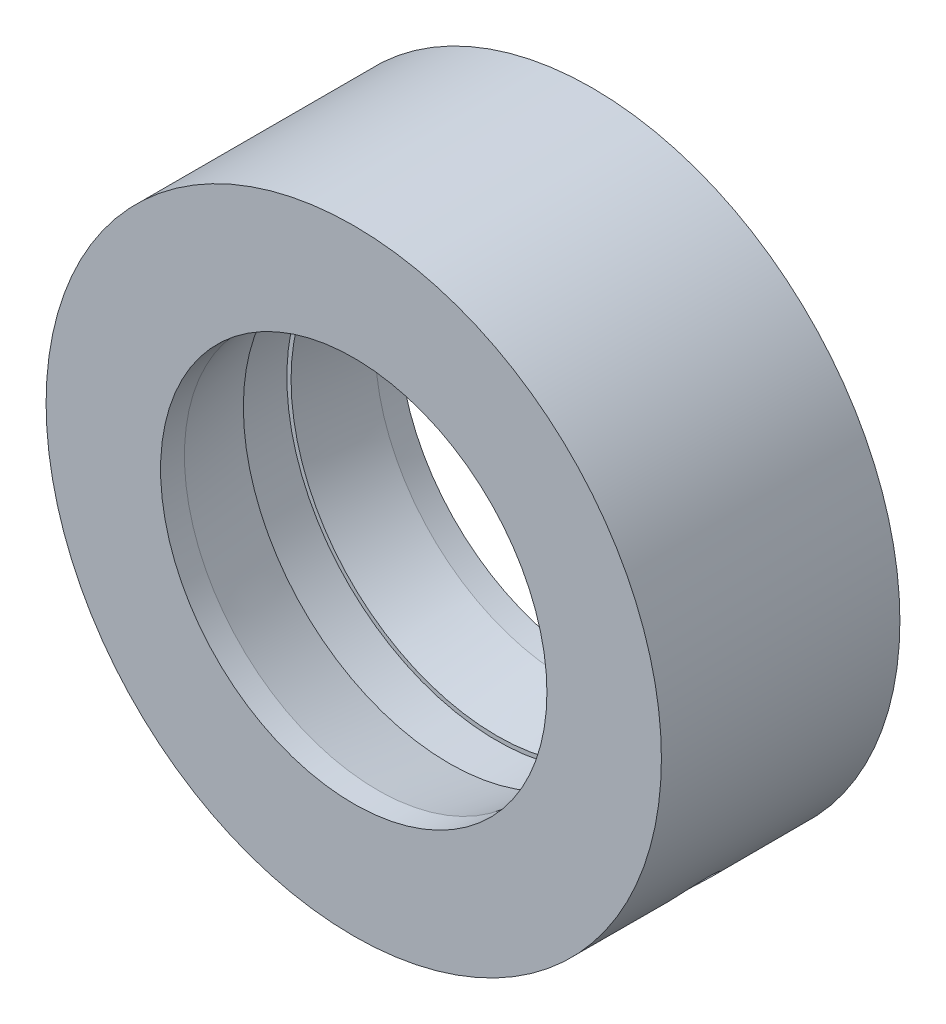
from build123d import *

# Parameters (mm, degrees)
SKETCH1_R               = 12.9
SKETCH1_R_2             = 8.1
BOSS_EXTRUDE1_DEPTH     = 8
CUT_EXTRUDE1_DEPTH      = 1
CUT_EXTRUDE1_DEPTH_BACK = 1
SKETCH3_R               = 8.805307923
SKETCH4_R               = 1
CUT_EXTRUDE2_DEPTH      = 6
FILLET1_R               = 3
FILLET2_R               = 5
SKETCH5_R               = 1
CUT_EXTRUDE3_DEPTH      = 10
DRAFT4_ANGLE            = -10
DRAFT6_ANGLE            = -10
SKETCH6_R               = 1
CUT_EXTRUDE4_DEPTH      = 10
BOSS_EXTRUDE3_START     = 1
SKETCH7_R               = 8.1
BOSS_EXTRUDE3_DEPTH     = 1
SKETCH11_R              = 8.1
BOSS_EXTRUDE4_DEPTH     = 1
SKETCH12_OUTSIDE_W      = 157.242
SKETCH12_OUTSIDE_H      = 107.242
SKETCH12_OUTSIDE_R      = 12.9
CUT_EXTRUDE5_DEPTH      = 108.3070569


with BuildPart() as part:
    # Sketch1 → Boss-Extrude1 (new body)
    # profile 1 of 8: a face of its own
    with BuildSketch(Plane.XY):
        with Locations((-26.538003558, 0)):
            Circle(SKETCH1_R)
        with Locations((-26.538003558, 0)):
            Circle(SKETCH1_R_2, mode=Mode.SUBTRACT)
    # profile 2 of 8: a face of its own
    with BuildSketch(Plane.XY):
        with BuildLine():
            ThreePointArc((-21.664910941, 11.944160429), (-17.46502072, 9.170113544), (-14.646409889, 5))
            Line((-14.646409889, 5), (-14.466935746, 5))
            Line((-14.466935746, 5), (18.588903825, 38.055839571))
            ThreePointArc((18.588903825, 38.055839571), (14.340318965, 40.878322523), (11.517836013, 45.126907383))
            Line((11.517836013, 45.126907383), (-21.664910941, 11.944160429))
        make_face()
    # profile 3 of 8: a face of its own
    with BuildSketch(Plane.XY):
        with BuildLine():
            Line((-14.466935746, 5), (-14.646409889, 5))
            ThreePointArc((-14.646409889, 5), (-14.619957589, 4.936616278), (-14.593843129, 4.873092617))
            Line((-14.593843129, 4.873092617), (-14.466935746, 5))
        make_face()
    # profile 4 of 8: a face of its own
    with BuildSketch(Plane.XY):
        with BuildLine():
            Line((61.39092863, 5), (-14.466935746, 5))
            Line((-14.466935746, 5), (-14.593843129, 4.873092617))
            ThreePointArc((-14.593843129, 4.873092617), (-13.879218673, 2.482975077), (-13.638003558, 0))
            ThreePointArc((-13.638003558, 0), (-13.892617871, -2.550337396), (-14.646409889, -5))
            Line((-14.646409889, -5), (61.570402773, -5))
            ThreePointArc((61.570402773, -5), (60.56217928, -0.068681781), (61.517836013, 4.873092617))
            Line((61.517836013, 4.873092617), (61.39092863, 5))
        make_face()
    # profile 5 of 8: a face of its own
    with BuildSketch(Plane.XY):
        with Locations((23.461996442, 50)):
            Circle(SKETCH1_R)
        with Locations((23.461996442, 50)):
            Circle(SKETCH1_R_2, mode=Mode.SUBTRACT)
    # profile 6 of 8: a face of its own
    with BuildSketch(Plane.XY):
        with BuildLine():
            Line((28.335089059, 38.055839571), (61.39092863, 5))
            Line((61.39092863, 5), (61.570402773, 5))
            ThreePointArc((61.570402773, 5), (64.389013604, 9.170113544), (68.588903825, 11.944160429))
            Line((68.588903825, 11.944160429), (35.406156871, 45.126907383))
            ThreePointArc((35.406156871, 45.126907383), (32.583673919, 40.878322523), (28.335089059, 38.055839571))
        make_face()
    # profile 7 of 8: a face of its own
    with BuildSketch(Plane.XY):
        with Locations((73.461996442, 0)):
            Circle(SKETCH1_R)
        with Locations((73.461996442, 0)):
            Circle(SKETCH1_R_2, mode=Mode.SUBTRACT)
    # profile 8 of 8: a face of its own
    with BuildSketch(Plane.XY):
        with BuildLine():
            Line((61.570402773, 5), (61.39092863, 5))
            Line((61.39092863, 5), (61.517836013, 4.873092617))
            ThreePointArc((61.517836013, 4.873092617), (61.543950473, 4.936616278), (61.570402773, 5))
        make_face()
    extrude(amount=BOSS_EXTRUDE1_DEPTH)

    # Sketch3 → Cut-Extrude1 (cut, two sides: drawn at the far end of the back side and taken through both)
    with BuildSketch(Plane.XY.offset(4).offset(-CUT_EXTRUDE1_DEPTH_BACK)):
        with Locations((-26.538003558, 0)):
            Circle(SKETCH3_R)
        with Locations((23.461996442, 50)):
            Circle(SKETCH3_R)
        with Locations((73.461996442, 0)):
            Circle(SKETCH3_R)
    extrude(amount=CUT_EXTRUDE1_DEPTH + CUT_EXTRUDE1_DEPTH_BACK, mode=Mode.SUBTRACT)

    # Sketch4 → Cut-Extrude2 (cut)
    with BuildSketch(Plane(origin=(0, 63.1, 0), x_dir=(-1, 0, 0), z_dir=(0, -1, 0))):
        with Locations(Location((-23.511996442, -4, 0), (0, 0, 270))):
            Circle(SKETCH4_R)
    extrude(amount=CUT_EXTRUDE2_DEPTH, mode=Mode.SUBTRACT)

    # Fillet1
    fillet1_edges = [part.edges().sort_by_distance(p)[0] for p in [
        (61.39092863, 5, 4),
        (28.335089059, 38.055839571, 4),
        (18.588903825, 38.055839571, 4),
        (-14.466935746, 5, 4),
    ]]
    fillet(fillet1_edges, radius=FILLET1_R)

    # Fillet2
    fillet2_edges = [part.edges().sort_by_distance(p)[0] for p in [
        (68.588903825, 11.944160429, 4),
        (61.570402773, -5, 4),
        (-14.646409889, -5, 4),
        (-21.664910941, 11.944160429, 4),
        (11.517836013, 45.126907383, 4),
        (35.406156871, 45.126907383, 4),
    ]]
    fillet(fillet2_edges, radius=FILLET2_R)

    # Sketch5 → Cut-Extrude3 (cut)
    with BuildSketch(Plane(origin=(45.994097055, -45.994097055, 0), x_dir=(0, 0, 1), z_dir=(-0.7071067811865489, 0.7071067811865462, 0))):
        with Locations(Location((4, 51.995475844, 0), (0, 0, 90))):
            Circle(SKETCH5_R)
    extrude(amount=CUT_EXTRUDE3_DEPTH, mode=Mode.SUBTRACT)

    # Draft4
    draft4_faces = [part.faces().sort_by_distance(p)[0] for p in [
        (-34.638003558, 0, 6.5),
        (15.361996442, 50, 6.5),
        (65.361996442, 0, 6.5),
    ]]
    draft(draft4_faces, Plane.XY.offset(8), DRAFT4_ANGLE)

    # Draft6
    draft6_faces = [part.faces().sort_by_distance(p)[0] for p in [
        (-34.638003558, 0, 1.5),
        (65.361996442, 0, 1.5),
        (15.361996442, 50, 1.5),
    ]]
    draft(draft6_faces, Plane(origin=(0, 0, 0), x_dir=(-1, 0, 0), z_dir=(0, 0, -1)), DRAFT6_ANGLE)

    # Sketch6 → Cut-Extrude4 (cut)
    with BuildSketch(Plane(origin=(-22.532100613, -22.532100613, 0), x_dir=(0, 0, -1), z_dir=(0.7071067811865486, 0.7071067811865465, 0))):
        with Locations(Location((-4, 18.715202275, 0), (0, 0, 270))):
            Circle(SKETCH6_R)
    extrude(amount=CUT_EXTRUDE4_DEPTH, mode=Mode.SUBTRACT)

    # Sketch7 → Boss-Extrude3 (add)
    with BuildSketch(Plane.XY.offset(8).offset(BOSS_EXTRUDE3_START)):
        with BuildLine():
            Line((66.499673424, 14.03339083), (37.495387272, 43.037676982))
            ThreePointArc((37.495387272, 43.037676982), (36.248927219, 45.112891138), (36.123400302, 47.53041455))
            ThreePointArc((36.123400302, 47.53041455), (23.461996442, 62.9), (10.800592582, 47.53041455))
            ThreePointArc((10.800592582, 47.53041455), (10.675065665, 45.112891138), (9.428605612, 43.037676982))
            Line((9.428605612, 43.037676982), (-19.57568054, 14.03339083))
            ThreePointArc((-19.57568054, 14.03339083), (-21.650894696, 12.786930777), (-24.068418108, 12.66140386))
            ThreePointArc((-24.068418108, 12.66140386), (-38.456049527, -4.936616278), (-15.838778411, -7.206703911))
            ThreePointArc((-15.838778411, -7.206703911), (-14.040570278, -5.586017646), (-11.69179192, -5))
            Line((-11.69179192, -5), (58.615784804, -5))
            ThreePointArc((58.615784804, -5), (60.964563162, -5.586017646), (62.762771295, -7.206703911))
            ThreePointArc((62.762771295, -7.206703911), (85.380042411, -4.936616278), (70.992410992, 12.66140386))
            ThreePointArc((70.992410992, 12.66140386), (68.57488758, 12.786930777), (66.499673424, 14.03339083))
        make_face()
        with Locations((-26.538003558, 0)):
            Circle(SKETCH7_R, mode=Mode.SUBTRACT)
        with Locations((73.461996442, 0)):
            Circle(SKETCH7_R, mode=Mode.SUBTRACT)
        with Locations((23.461996442, 50)):
            Circle(SKETCH7_R, mode=Mode.SUBTRACT)
        with BuildLine():
            Line((-7.224295059, 5), (54.148287943, 5))
            ThreePointArc((54.148287943, 5), (56.919926541, 6.851949703), (56.269608287, 10.121320344))
            Line((56.269608287, 10.121320344), (29.642686082, 36.748242548))
            ThreePointArc((29.642686082, 36.748242548), (28.303088236, 37.523283704), (26.755447003, 37.52750292))
            ThreePointArc((26.755447003, 37.52750292), (23.461996442, 37.1), (20.168545881, 37.52750292))
            ThreePointArc((20.168545881, 37.52750292), (18.620904648, 37.523283704), (17.281306802, 36.748242548))
            Line((17.281306802, 36.748242548), (-9.345615403, 10.121320344))
            ThreePointArc((-9.345615403, 10.121320344), (-9.995933657, 6.851949703), (-7.224295059, 5))
        make_face(mode=Mode.SUBTRACT)
    extrude(amount=-BOSS_EXTRUDE3_DEPTH)

    # Sketch11 → Boss-Extrude4 (add)
    with BuildSketch(Plane(origin=(0, 0, 0), x_dir=(-1, 0, 0), z_dir=(0, 0, -1))):
        with BuildLine():
            Line((-37.495387272, 43.037676982), (-66.499673424, 14.03339083))
            ThreePointArc((-66.499673424, 14.03339083), (-68.57488758, 12.786930777), (-70.992410992, 12.66140386))
            ThreePointArc((-70.992410992, 12.66140386), (-85.380042411, -4.936616278), (-62.762771295, -7.206703911))
            ThreePointArc((-62.762771295, -7.206703911), (-60.964563162, -5.586017646), (-58.615784804, -5))
            Line((-58.615784804, -5), (11.69179192, -5))
            ThreePointArc((11.69179192, -5), (14.040570278, -5.586017646), (15.838778411, -7.206703911))
            ThreePointArc((15.838778411, -7.206703911), (38.456049527, -4.936616278), (24.068418108, 12.66140386))
            ThreePointArc((24.068418108, 12.66140386), (21.650894696, 12.786930777), (19.57568054, 14.03339083))
            Line((19.57568054, 14.03339083), (-9.428605612, 43.037676982))
            ThreePointArc((-9.428605612, 43.037676982), (-10.675065665, 45.112891138), (-10.800592582, 47.53041455))
            ThreePointArc((-10.800592582, 47.53041455), (-23.461996442, 62.9), (-36.123400302, 47.53041455))
            ThreePointArc((-36.123400302, 47.53041455), (-36.248927219, 45.112891138), (-37.495387272, 43.037676982))
        make_face()
        with Locations(Location((-73.461996442, 0, 0), (0, 0, 180))):
            Circle(SKETCH11_R, mode=Mode.SUBTRACT)
        with Locations(Location((-23.461996442, 50, 0), (0, 0, 180))):
            Circle(SKETCH11_R, mode=Mode.SUBTRACT)
        with Locations(Location((26.538003558, 0, 0), (0, 0, 180))):
            Circle(SKETCH11_R, mode=Mode.SUBTRACT)
        with BuildLine():
            Line((-17.281306802, 36.748242548), (9.345615403, 10.121320344))
            ThreePointArc((9.345615403, 10.121320344), (9.995933657, 6.851949703), (7.224295059, 5))
            Line((7.224295059, 5), (-54.148287943, 5))
            ThreePointArc((-54.148287943, 5), (-56.919926541, 6.851949703), (-56.269608287, 10.121320344))
            Line((-56.269608287, 10.121320344), (-29.642686082, 36.748242548))
            ThreePointArc((-29.642686082, 36.748242548), (-28.303088236, 37.523283704), (-26.755447003, 37.52750292))
            ThreePointArc((-26.755447003, 37.52750292), (-23.461996442, 37.1), (-20.168545881, 37.52750292))
            ThreePointArc((-20.168545881, 37.52750292), (-18.620904648, 37.523283704), (-17.281306802, 36.748242548))
        make_face(mode=Mode.SUBTRACT)
    extrude(amount=BOSS_EXTRUDE4_DEPTH)

    # Sketch12 outside → Cut-Extrude5 (cut, through all)
    with BuildSketch(Plane(origin=(0, 0, -1), x_dir=(-1, 0, 0), z_dir=(0, 0, -1))):
        with Locations((-23.462, 25)):
            Rectangle(SKETCH12_OUTSIDE_W, SKETCH12_OUTSIDE_H)
        with Locations((-73.461996442, 0)):
            Circle(SKETCH12_OUTSIDE_R, mode=Mode.SUBTRACT)
    extrude(amount=-CUT_EXTRUDE5_DEPTH, mode=Mode.SUBTRACT)


solid = part.part
